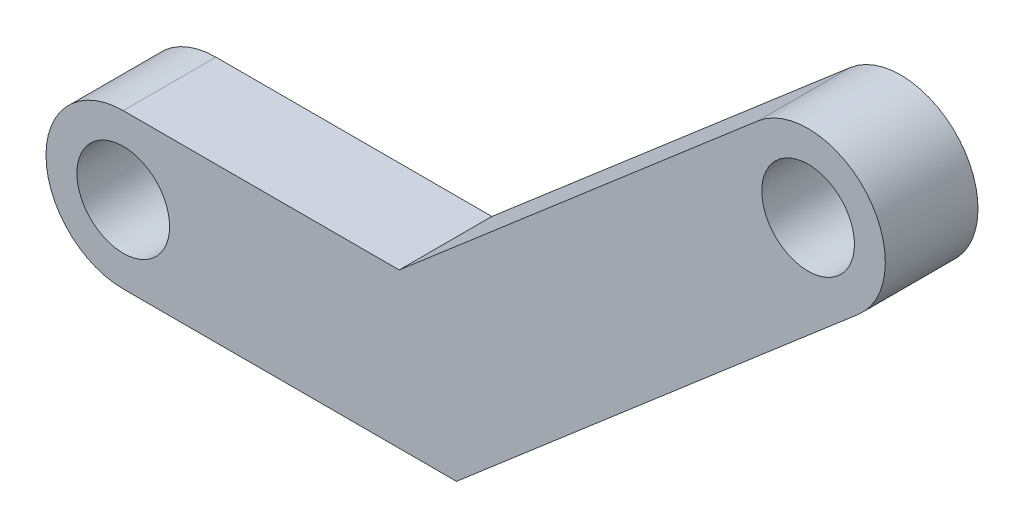
from build123d import *

# Parameters (mm, degrees)
SKETCH1_R           = 15
BOSS_EXTRUDE1_DEPTH = 30


with BuildPart() as part:
    # Sketch1 → Boss-Extrude1 (new body)
    with BuildSketch(Plane.XY):
        with BuildLine():
            Line((75.689693524, 135.478733708), (-40.381263603, 35.677200992))
            Line((-40.381263603, 35.677200992), (-129.711154614, 35.677200992))
            ThreePointArc((-129.711154614, 35.677200992), (-154.711154614, 10.677200992), (-129.711154614, -14.322799008))
            Line((-129.711154614, -14.322799008), (-21.841045625, -14.322799008))
            Line((-21.841045625, -14.322799008), (108.287997249, 97.566326843))
            ThreePointArc((108.287997249, 97.566326843), (110.945048819, 132.821682138), (75.689693524, 135.478733708))
        make_face()
        with Locations((91.988845386, 116.522530275)):
            Circle(SKETCH1_R, mode=Mode.SUBTRACT)
        with Locations((-129.711154614, 10.677200992)):
            Circle(SKETCH1_R, mode=Mode.SUBTRACT)
    extrude(amount=BOSS_EXTRUDE1_DEPTH)


solid = part.part
